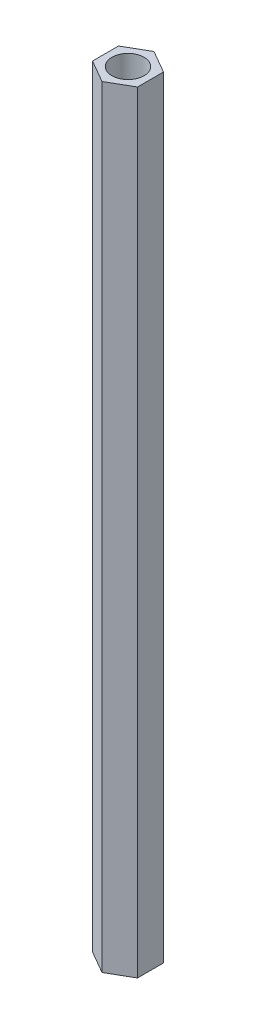
from build123d import *

# Parameters (mm, degrees)
BOSS_EXTRUDE1_DEPTH       = 60
M3X0_5_TAPPED_HOLE1_D     = 2.5
M3X0_5_TAPPED_HOLE1_DEPTH = 10
M3X0_5_TAPPED_HOLE1_TIP   = 0.751075774
M3X0_5_TAPPED_HOLE2_D     = 2.5
M3X0_5_TAPPED_HOLE2_DEPTH = 10
M3X0_5_TAPPED_HOLE2_TIP   = 0.751075774


with BuildPart() as part:
    # Sketch1 → Boss-Extrude1 (new body)
    with BuildSketch(Plane(origin=(0, 0, 0), x_dir=(1, 0, 0), z_dir=(0, 1, 0))):
        Polygon((0, 2.020725942), (-1.75, 1.010362971), (-1.75, -1.010362971), (0, -2.020725942), (1.75, -1.010362971), (1.75, 1.010362971), align=None)
    extrude(amount=BOSS_EXTRUDE1_DEPTH)

    # M3x0.5 Tapped Hole1
    with Locations(Plane(origin=(0, 60, 0), x_dir=(1, 0, 0), z_dir=(0, 1, 0))):
        with Locations((0, 0)):
            Hole(M3X0_5_TAPPED_HOLE1_D / 2, depth=M3X0_5_TAPPED_HOLE1_DEPTH)
            with Locations((0, 0, -(M3X0_5_TAPPED_HOLE1_DEPTH + M3X0_5_TAPPED_HOLE1_TIP / 2))):  # 118° drill point
                Cone(0, M3X0_5_TAPPED_HOLE1_D / 2, M3X0_5_TAPPED_HOLE1_TIP, mode=Mode.SUBTRACT)

    # M3x0.5 Tapped Hole2
    with Locations(Plane(origin=(0, 0, 0), x_dir=(-1, 0, 0), z_dir=(0, -1, 0))):
        with Locations((0, 0)):
            Hole(M3X0_5_TAPPED_HOLE2_D / 2, depth=M3X0_5_TAPPED_HOLE2_DEPTH)
            with Locations((0, 0, -(M3X0_5_TAPPED_HOLE2_DEPTH + M3X0_5_TAPPED_HOLE2_TIP / 2))):  # 118° drill point
                Cone(0, M3X0_5_TAPPED_HOLE2_D / 2, M3X0_5_TAPPED_HOLE2_TIP, mode=Mode.SUBTRACT)


solid = part.part
